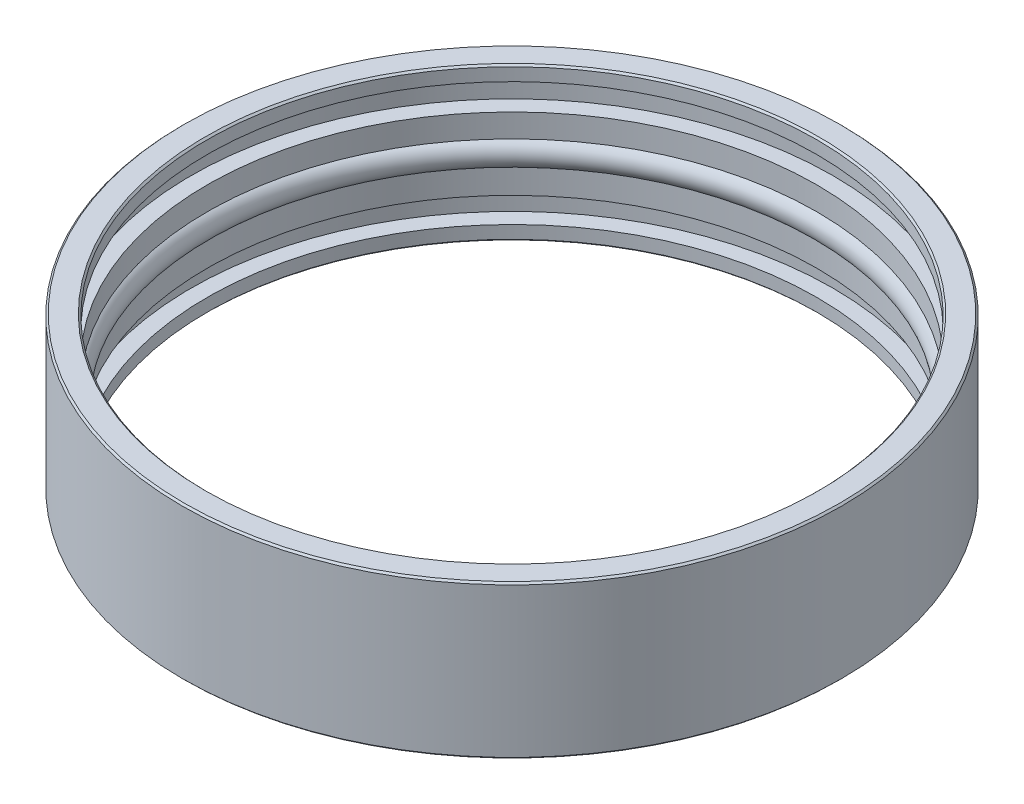
from build123d import *

# Parameters (mm, degrees)
CHANFRO1_SIZE = 0.3


with BuildPart() as part:
    # Esboço1 → Revolução1 (revolve)
    with BuildSketch(Plane.XY, mode=Mode.PRIVATE) as revolu_o1_sk:
        with BuildLine():
            Line((52.25, 6.703459888), (56.5, 6.703459888))
            Line((56.5, 6.703459888), (56.5, -19.496540112))
            Line((56.5, -19.496540112), (52.25, -19.496540112))
            Line((52.25, -19.496540112), (52.25, -16.996540112))
            Line((52.25, -16.996540112), (55, -16.996540112))
            Line((55, -16.996540112), (55, -12.670733082))
            Line((55, -12.670733082), (52.25, -12.670733082))
            Line((52.25, -12.670733082), (52.25, -8.496540112))
            ThreePointArc((52.25, -8.496540112), (51.106465997, -6.396540112), (52.25, -4.296540112))
            Line((52.25, -4.296540112), (52.25, -0.296540112))
            Line((52.25, -0.296540112), (55, -0.296540112))
            Line((55, -0.296540112), (55, 4.203459888))
            Line((55, 4.203459888), (52.25, 4.203459888))
            Line((52.25, 4.203459888), (52.25, 6.703459888))
        make_face()
    revolve(revolu_o1_sk.sketch.rotate(Axis((0, -46.184315802, 0), (0, 1, 0)), 90), axis=Axis((0, -46.184315802, 0), (0, 1, 0)))

    # Chanfro1
    chanfro1_edges = [part.edges().sort_by_distance(p)[0] for p in [
        (0, -19.496540112, 52.25),
        (0, -19.496540112, 56.5),
        (0, 6.703459888, 56.5),
        (0, 6.703459888, 52.25),
    ]]
    chamfer(chanfro1_edges, length=CHANFRO1_SIZE)


solid = part.part
